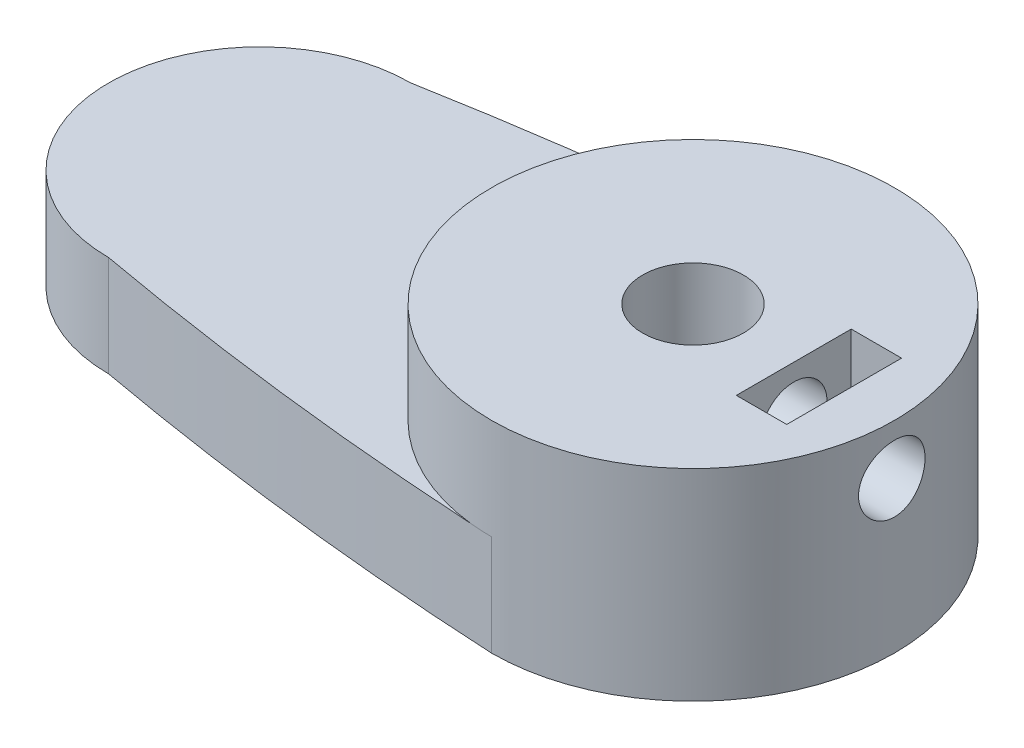
from build123d import *

# Parameters (mm, degrees)
SKETCH1_R           = 2.5
BOSS_EXTRUDE1_DEPTH = 5
SKETCH2_R           = 10
SKETCH2_R_2         = 2.5
BOSS_EXTRUDE2_DEPTH = 5
SKETCH3_W           = 2.5
SKETCH3_H           = 5.7
CUT_EXTRUDE1_DEPTH  = 5
SKETCH4_R           = 1.65
CUT_EXTRUDE2_DEPTH  = 25


with BuildPart() as part:
    # Sketch1 → Boss-Extrude1 (new body)
    with BuildSketch(Plane(origin=(0, 0, 0), x_dir=(1, 0, 0), z_dir=(0, 1, 0))):
        with BuildLine():
            ThreePointArc((-21.5, -7.5), (-11.330511131, -9.033592317), (-1.086131732, -9.940840903))
            ThreePointArc((-1.086131732, -9.940840903), (-0.543113838, -9.971301197), (0, -10))
            ThreePointArc((0, -10), (10, 0), (0, 10))
            ThreePointArc((0, 10), (-0.543113838, 9.971301197), (-1.086131732, 9.940840903))
            ThreePointArc((-1.086131732, 9.940840903), (-11.330511131, 9.033592317), (-21.5, 7.5))
            ThreePointArc((-21.5, 7.5), (-29, 0), (-21.5, -7.5))
        make_face()
        with Locations(Location((0, 0, 0), (0, 0, 270))):
            Circle(SKETCH1_R, mode=Mode.SUBTRACT)
    extrude(amount=BOSS_EXTRUDE1_DEPTH)

    # Sketch2 → Boss-Extrude2 (add)
    with BuildSketch(Plane(origin=(0, 5, 0), x_dir=(1, 0, 0), z_dir=(0, 1, 0))):
        with Locations(Location((0, 0, 0), (0, 0, 270))):
            Circle(SKETCH2_R)
        with Locations(Location((0, 0, 0), (0, 0, 270))):
            Circle(SKETCH2_R_2, mode=Mode.SUBTRACT)
    extrude(amount=BOSS_EXTRUDE2_DEPTH)

    # Sketch3 → Cut-Extrude1 (cut)
    with BuildSketch(Plane(origin=(0, 10, 0), x_dir=(1, 0, 0), z_dir=(0, 1, 0))):
        with Locations((6.25, 0)):
            Rectangle(SKETCH3_W, SKETCH3_H)
    extrude(amount=-CUT_EXTRUDE1_DEPTH, mode=Mode.SUBTRACT)

    # Sketch4 → Cut-Extrude2 (cut)
    with BuildSketch(Plane(origin=(0, 0, 0), x_dir=(0, 0, -1), z_dir=(1, 0, 0))):
        with Locations(Location((0, 7.5, 0), (0, 0, 180))):
            Circle(SKETCH4_R)
    extrude(amount=CUT_EXTRUDE2_DEPTH, mode=Mode.SUBTRACT)


solid = part.part
